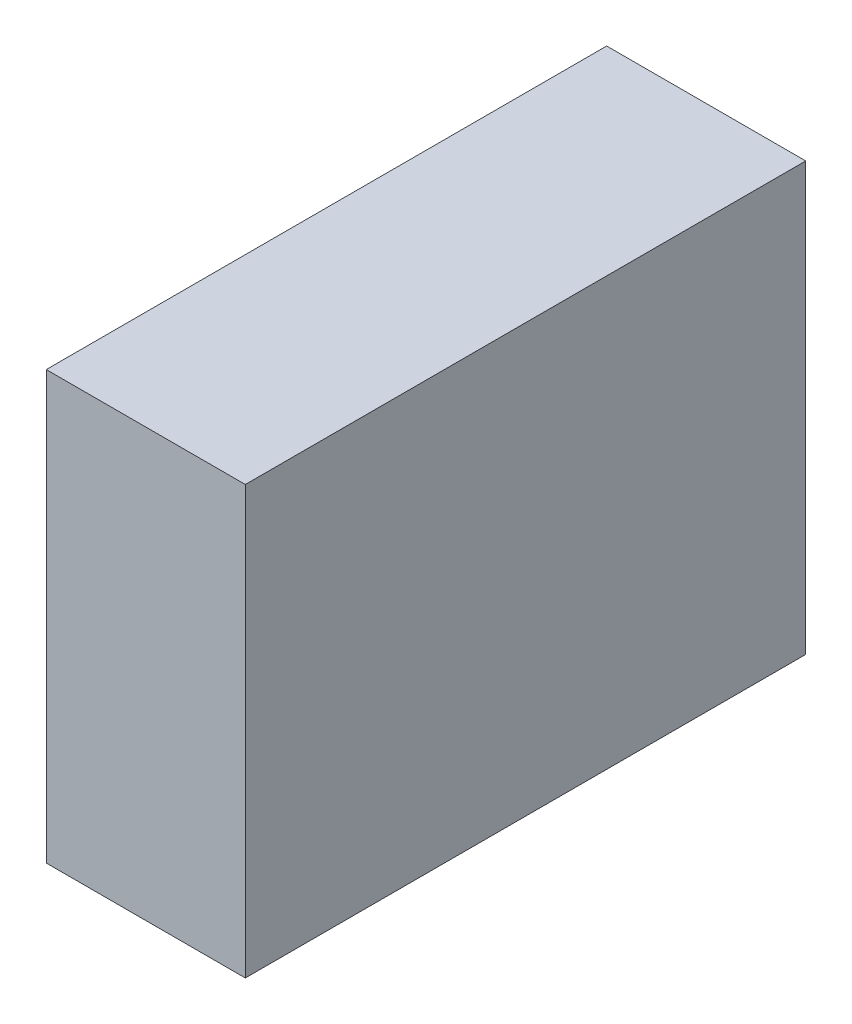
from build123d import *

# Parameters (mm, degrees)
SKETCH1_W                 = 53.594
SKETCH1_H                 = 150.876
BOSS_EXTRUDE1_DEPTH       = 115.062
F_6_CLEARANCE_HOLE1_D     = 4.3053
F_6_CLEARANCE_HOLE1_DEPTH = 9.144
F_6_CLEARANCE_HOLE1_TIP   = 1.293442612


with BuildPart() as part:
    # Sketch1 → Boss-Extrude1 (new body)
    with BuildSketch(Plane(origin=(0, 0, 0), x_dir=(1, 0, 0), z_dir=(0, 1, 0))):
        Rectangle(SKETCH1_W, SKETCH1_H)
    extrude(amount=BOSS_EXTRUDE1_DEPTH)

    # #6 Clearance Hole1
    with Locations(Plane.XZ):
        with Locations((18.034, 69.977), (-18.034, 69.977), (-18.034, -69.977), (18.034, -69.977)):
            Hole(F_6_CLEARANCE_HOLE1_D / 2, depth=F_6_CLEARANCE_HOLE1_DEPTH)
            with Locations((0, 0, -(F_6_CLEARANCE_HOLE1_DEPTH + F_6_CLEARANCE_HOLE1_TIP / 2))):  # 118° drill point
                Cone(0, F_6_CLEARANCE_HOLE1_D / 2, F_6_CLEARANCE_HOLE1_TIP, mode=Mode.SUBTRACT)


solid = part.part
